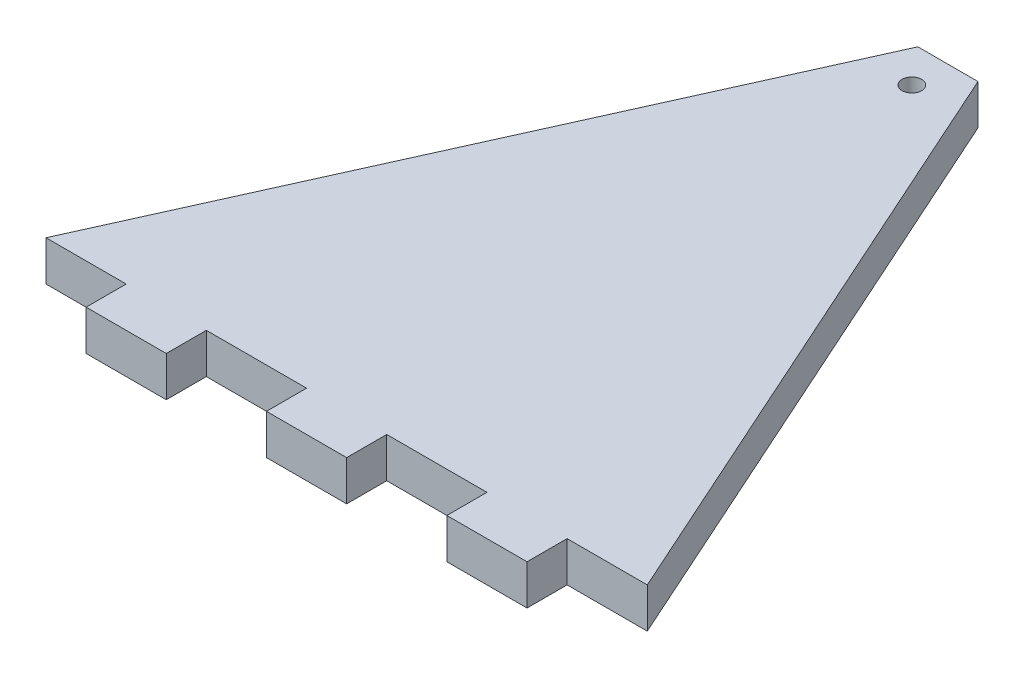
from build123d import *

# Parameters (mm, degrees)
SKETCH1_R           = 2.45
BOSS_EXTRUDE1_DEPTH = 10


with BuildPart() as part:
    # Sketch1 → Boss-Extrude1 (new body)
    with BuildSketch(Plane(origin=(0, 0, 0), x_dir=(1, 0, 0), z_dir=(0, 1, 0))):
        Polygon((-7.5, 75), (7.5, 75), (75, -75), (55, -75), (55, -85), (35, -85), (35, -75), (10, -75), (10, -85), (-10, -85), (-10, -75), (-35, -75), (-35, -85), (-55, -85), (-55, -75), (-75, -75), align=None)
        with Locations(Location((0, 66, 0), (0, 0, 270))):
            Circle(SKETCH1_R, mode=Mode.SUBTRACT)
    extrude(amount=BOSS_EXTRUDE1_DEPTH)


solid = part.part
